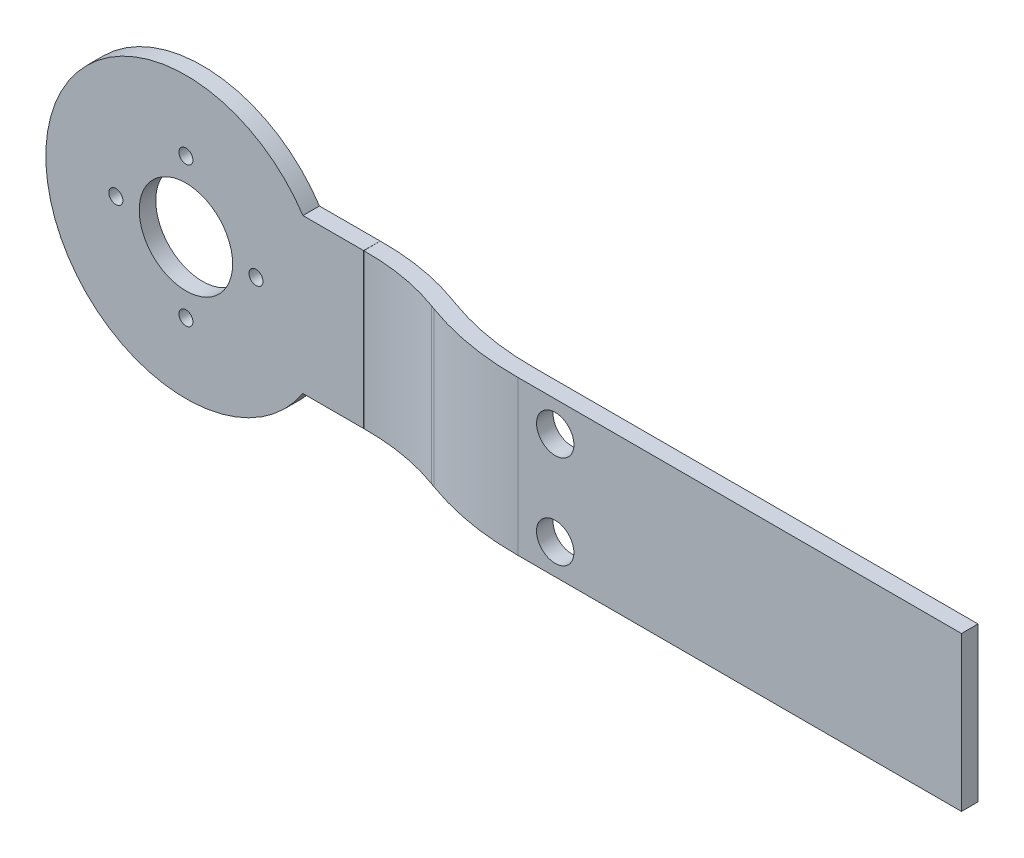
from build123d import *

# Parameters (mm, degrees)
SKETCH1_R           = 30
BOSS_EXTRUDE1_DEPTH = 3.54
BOSS_EXTRUDE4_START = -3.54
BOSS_EXTRUDE4_DEPTH = 3.54
CUT_EXTRUDE1_REACH  = 50.587
SKETCH5_R           = 10
CUT_EXTRUDE2_REACH  = 50.587
SKETCH6_R           = 1.5
BOSS_EXTRUDE5_DEPTH = 33
SKETCH8_R           = 4
CUT_EXTRUDE3_DEPTH  = 10


with BuildPart() as part:
    # Sketch1 → Boss-Extrude1 (new body)
    with BuildSketch(Plane.XY):
        Circle(SKETCH1_R)
    extrude(amount=BOSS_EXTRUDE1_DEPTH)

    # Sketch4 → Boss-Extrude4 (add)
    with BuildSketch(Plane.XY.offset(3.54).offset(BOSS_EXTRUDE4_START)):
        with BuildLine():
            Line((25.054939633, 16.5), (38.054939633, 16.5))
            Line((38.054939633, 16.5), (38.054939633, -16.5))
            Line((38.054939633, -16.5), (25.054939633, -16.5))
            ThreePointArc((25.054939633, -16.5), (30, 0), (25.054939633, 16.5))
        make_face()
    extrude(amount=BOSS_EXTRUDE4_DEPTH)

    # Sketch5 → Cut-Extrude1 (cut, up to next)
    with BuildSketch(Plane.XY.offset(3.54), mode=Mode.PRIVATE) as cut_extrude1_sk1:
        Circle(SKETCH5_R)
    cut_extrude1_tool1 = extrude(cut_extrude1_sk1.sketch, amount=-CUT_EXTRUDE1_REACH, mode=Mode.PRIVATE) & part.part
    add(cut_extrude1_tool1.solids().sort_by_distance((0, 0, 3.54))[0], mode=Mode.SUBTRACT)

    # Sketch6 → Cut-Extrude2 (cut, up to next)
    with BuildSketch(Plane.XY.offset(3.54), mode=Mode.PRIVATE) as cut_extrude2_sk1:
        with Locations((0, 15)):
            Circle(SKETCH6_R)
    cut_extrude2_tool1 = extrude(cut_extrude2_sk1.sketch, amount=-CUT_EXTRUDE2_REACH, mode=Mode.PRIVATE) & part.part
    # Sketch6 → Cut-Extrude2 (cut, up to next)
    with BuildSketch(Plane.XY.offset(3.54), mode=Mode.PRIVATE) as cut_extrude2_sk2:
        with Locations((15, 0)):
            Circle(SKETCH6_R)
    cut_extrude2_tool2 = extrude(cut_extrude2_sk2.sketch, amount=-CUT_EXTRUDE2_REACH, mode=Mode.PRIVATE) & part.part
    # Sketch6 → Cut-Extrude2 (cut, up to next)
    with BuildSketch(Plane.XY.offset(3.54), mode=Mode.PRIVATE) as cut_extrude2_sk3:
        with Locations((0, -15)):
            Circle(SKETCH6_R)
    cut_extrude2_tool3 = extrude(cut_extrude2_sk3.sketch, amount=-CUT_EXTRUDE2_REACH, mode=Mode.PRIVATE) & part.part
    # Sketch6 → Cut-Extrude2 (cut, up to next)
    with BuildSketch(Plane.XY.offset(3.54), mode=Mode.PRIVATE) as cut_extrude2_sk4:
        with Locations((-15, 0)):
            Circle(SKETCH6_R)
    cut_extrude2_tool4 = extrude(cut_extrude2_sk4.sketch, amount=-CUT_EXTRUDE2_REACH, mode=Mode.PRIVATE) & part.part
    add(cut_extrude2_tool1.solids().sort_by_distance((0, 15, 3.54))[0], mode=Mode.SUBTRACT)
    add(cut_extrude2_tool2.solids().sort_by_distance((15, 0, 3.54))[0], mode=Mode.SUBTRACT)
    add(cut_extrude2_tool3.solids().sort_by_distance((0, -15, 3.54))[0], mode=Mode.SUBTRACT)
    add(cut_extrude2_tool4.solids().sort_by_distance((-15, 0, 3.54))[0], mode=Mode.SUBTRACT)


with BuildPart() as body_2:
    # Sketch7 → Boss-Extrude5 (new body)
    with BuildSketch(Plane(origin=(0, 16.5, 0), x_dir=(1, 0, 0), z_dir=(0, 1, 0))):
        with BuildLine():
            Line((78.054939633, -7), (173.054939633, -7))
            Line((173.054939633, -7), (173.054939633, -10.54))
            Line((173.054939633, -10.54), (78.070990419, -10.54))
            ThreePointArc((78.070990419, -10.54), (67.072567905, -9.651997942), (56.407983509, -6.819951839))
            Line((56.407983509, -6.819951839), (55.496978315, -6.488373065))
            ThreePointArc((55.496978315, -6.488373065), (46.933290058, -4.224083077), (38.101791219, -3.539689948))
            Line((38.101791219, -3.539689948), (38.054939633, 0))
            ThreePointArc((38.054939633, 0), (47.524920739, -0.733872032), (56.707729622, -3.161861188))
            Line((56.707729622, -3.161861188), (57.618734817, -3.493439962))
            ThreePointArc((57.618734817, -3.493439962), (67.679379066, -6.164384916), (78.054939633, -7))
        make_face()
    extrude(amount=-BOSS_EXTRUDE5_DEPTH)

    # Sketch8 → Cut-Extrude3 (cut)
    with BuildSketch(Plane.XY.offset(10.54)):
        with Locations((86.070990419, 10)):
            Circle(SKETCH8_R)
        with Locations(Location((86.070990419, -10, 0), (0, 0, 180))):
            Circle(SKETCH8_R)
    extrude(amount=-CUT_EXTRUDE3_DEPTH, mode=Mode.SUBTRACT)


solid = Compound([part.part, body_2.part])
